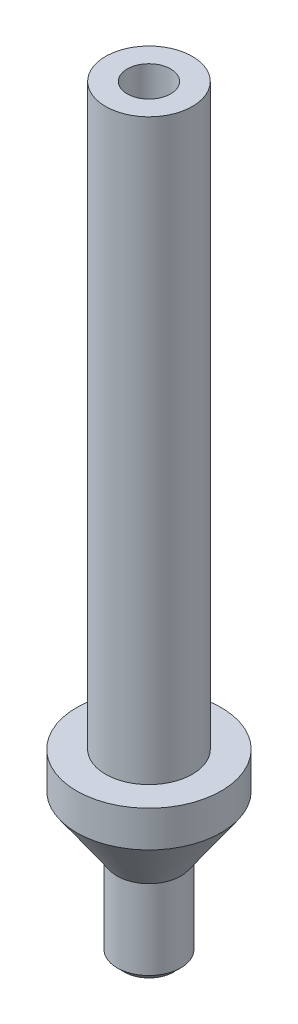
from build123d import *

# Parameters (mm, degrees)
CUT_EXTRUDE1_DEPTH      = 53.974050251
CUT_EXTRUDE1_DEPTH_BACK = 53.974050251
SKETCH2_R               = 1.075
CUT_EXTRUDE2_DEPTH      = 53.974050251
CUT_EXTRUDE2_DEPTH_BACK = 20
SKETCH3_R               = 1.5
CHAMFER1_SIZE           = 0.5


with BuildPart() as part:
    # Sketch1 → Revolve1 (revolve)
    with BuildSketch(Plane(origin=(0, 0, 0), x_dir=(0, 0, -1), z_dir=(1, 0, 0))):
        Polygon((0, 0), (-2.2, 0), (-2.2, 6.001185581), (-5, 10), (-5, 12.5), (-3, 12.5), (-3, 52.5), (0, 52.5), align=None)
    revolve(axis=Axis((0, 52.5, 0), (0, -1, 0)))

    # Sketch2 → Cut-Extrude1 (cut, two sides: drawn at the far end of the back side and taken through both)
    with BuildSketch(Plane(origin=(0, 52.5, 0), x_dir=(1, 0, 0), z_dir=(0, 1, 0)).offset(-CUT_EXTRUDE1_DEPTH_BACK)):
        with Locations(Location((0, 0, 0), (0, 0, 270))):
            Circle(SKETCH2_R)
    extrude(amount=CUT_EXTRUDE1_DEPTH + CUT_EXTRUDE1_DEPTH_BACK, mode=Mode.SUBTRACT)

    # Sketch3 → Cut-Extrude2 (cut, two sides: drawn at the far end of the back side and taken through both)
    with BuildSketch(Plane(origin=(0, 52.5, 0), x_dir=(1, 0, 0), z_dir=(0, 1, 0)).offset(-CUT_EXTRUDE2_DEPTH_BACK)):
        with Locations(Location((0, 0, 0), (0, 0, 270))):
            Circle(SKETCH3_R)
    extrude(amount=CUT_EXTRUDE2_DEPTH + CUT_EXTRUDE2_DEPTH_BACK, mode=Mode.SUBTRACT)

    # Chamfer1
    chamfer1_edges = [part.edges().sort_by_distance(p)[0] for p in [
        (0, 0, -2.2),
    ]]
    chamfer(chamfer1_edges, length=CHAMFER1_SIZE)


solid = part.part
